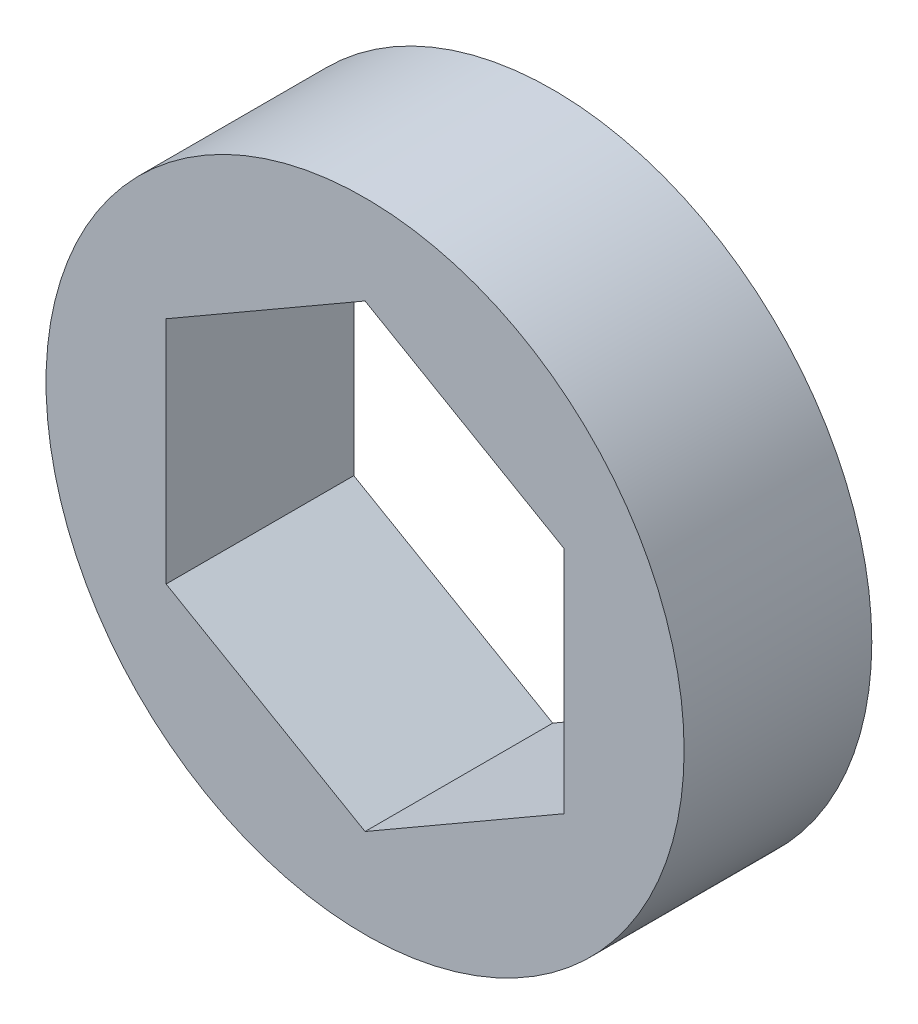
from build123d import *

# Parameters (mm, degrees)
SKETCH1_R           = 10.795
BOSS_EXTRUDE1_DEPTH = 6.35


with BuildPart() as part:
    # Sketch1 → Boss-Extrude1 (new body)
    with BuildSketch(Plane.XY):
        Circle(SKETCH1_R)
        Polygon((0, 7.772289324), (-6.731, 3.886144662), (-6.731, -3.886144662), (0, -7.772289324), (6.731, -3.886144662), (6.731, 3.886144662), align=None, mode=Mode.SUBTRACT)
    extrude(amount=BOSS_EXTRUDE1_DEPTH)


solid = part.part
